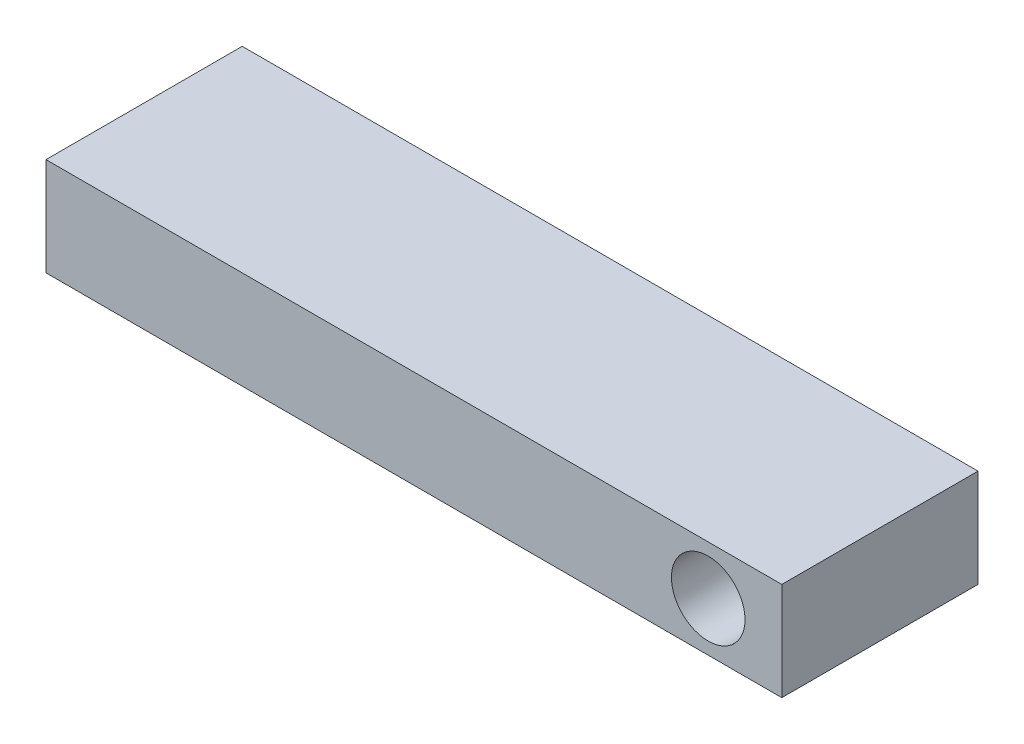
from build123d import *

# Parameters (mm, degrees)
SKETCH1_W           = 95.25
SKETCH1_H           = 12.7
SKETCH1_R           = 4.7625
BOSS_EXTRUDE1_DEPTH = 25.4


with BuildPart() as part:
    # Sketch1 → Boss-Extrude1 (new body)
    with BuildSketch(Plane.XY):
        with Locations((47.625, 6.35)):
            Rectangle(SKETCH1_W, SKETCH1_H)
        with Locations((85.725, 6.35)):
            Circle(SKETCH1_R, mode=Mode.SUBTRACT)
    extrude(amount=BOSS_EXTRUDE1_DEPTH)


solid = part.part
